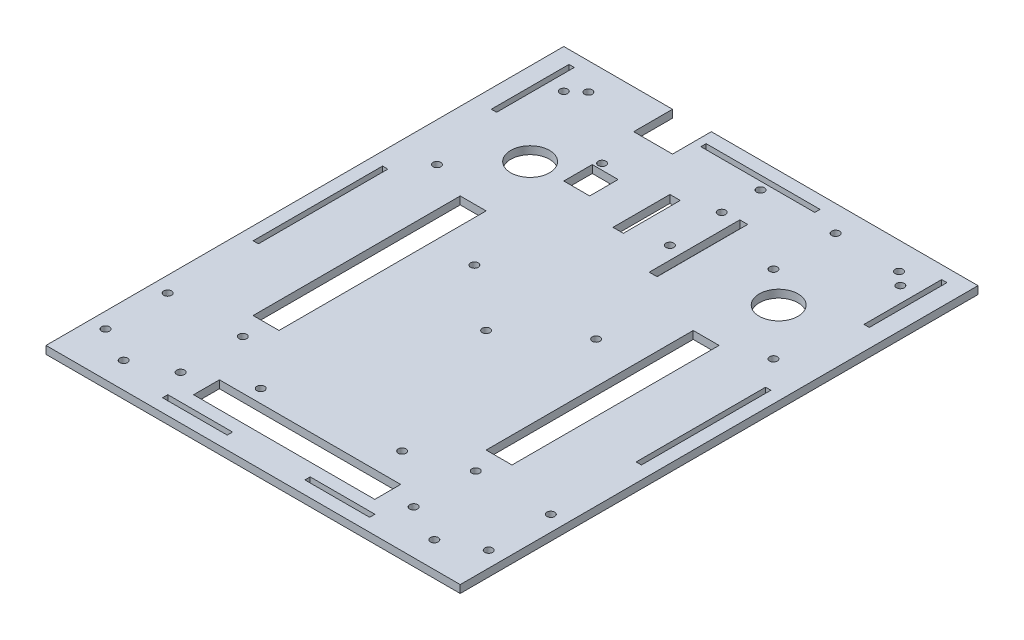
from build123d import *

# Parameters (mm, degrees)
SKETCH1_W           = 160
SKETCH1_H           = 200
BOSS_EXTRUDE1_DEPTH = 3
SKETCH2_R           = 1.5
SKETCH2_W           = 25
SKETCH2_H           = 2.05
SKETCH2_W_2         = 2.05
SKETCH2_H_2         = 50
SKETCH2_H_3         = 30
SKETCH2_W_3         = 15
SKETCH2_H_4         = 15
SKETCH2_W_4         = 44
SKETCH2_W_5         = 4
SKETCH2_H_5         = 22
SKETCH2_W_6         = 3.05
SKETCH2_H_6         = 35
CUT_EXTRUDE1_DEPTH  = 3
SKETCH3_R           = 1.5
CUT_EXTRUDE2_DEPTH  = 129.097619025
SKETCH4_R           = 7.5
SKETCH4_R_2         = 1.5
SKETCH4_W           = 10
SKETCH4_H           = 80
SKETCH4_W_2         = 70
SKETCH4_H_2         = 10
CUT_EXTRUDE3_DEPTH  = 3
SKETCH5_R           = 1.5
CUT_EXTRUDE4_DEPTH  = 10
SKETCH6_R           = 1.5
SKETCH6_W           = 10
SKETCH6_H           = 11
CUT_EXTRUDE5_DEPTH  = 10


with BuildPart() as part:
    # Sketch1 → Boss-Extrude1 (new body)
    with BuildSketch(Plane(origin=(0, 0, 0), x_dir=(1, 0, 0), z_dir=(0, 1, 0))):
        Rectangle(SKETCH1_W, SKETCH1_H)
    extrude(amount=BOSS_EXTRUDE1_DEPTH)

    # Sketch2 → Cut-Extrude1 (cut)
    with BuildSketch(Plane(origin=(0, 3, 0), x_dir=(1, 0, 0), z_dir=(0, 1, 0))):
        with Locations(Location((-60, -90, 0), (0, 0, 270))):
            Circle(SKETCH2_R)
        with Locations(Location((60, -90, 0), (0, 0, 90))):
            Circle(SKETCH2_R)
        with Locations(Location((0, -10, 0), (0, 0, 270))):
            Circle(SKETCH2_R)
        with Locations(Location((-65, 85, 0), (0, 0, 270))):
            Circle(SKETCH2_R)
        with Locations(Location((65, 85, 0), (0, 0, 90))):
            Circle(SKETCH2_R)
        with Locations((27.5, -93.975)):
            Rectangle(SKETCH2_W, SKETCH2_H)
        with Locations((-27.5, -93.975)):
            Rectangle(SKETCH2_W, SKETCH2_H)
        with Locations((73.975, 0)):
            Rectangle(SKETCH2_W_2, SKETCH2_H_2)
        with Locations((-73.975, 0)):
            Rectangle(SKETCH2_W_2, SKETCH2_H_2)
        with Locations((71.975, 80)):
            Rectangle(SKETCH2_W_2, SKETCH2_H_3)
        with Locations((-30.5, 92.5)):
            Rectangle(SKETCH2_W_3, SKETCH2_H_4)
        with Locations((2, 93.975)):
            Rectangle(SKETCH2_W_4, SKETCH2_H)
        with Locations((-71.975, 80)):
            Rectangle(SKETCH2_W_2, SKETCH2_H_3)
        with Locations((-8, 60)):
            Rectangle(SKETCH2_W_5, SKETCH2_H_5)
        with Locations((13.525, 58.5)):
            Rectangle(SKETCH2_W_6, SKETCH2_H_6)
    extrude(amount=-CUT_EXTRUDE1_DEPTH, mode=Mode.SUBTRACT)

    # Sketch3 → Cut-Extrude2 (cut, through all)
    with BuildSketch(Plane(origin=(0, 3, 0), x_dir=(1, 0, 0), z_dir=(0, 1, 0))):
        with Locations(Location((-24.13, 9.6, 0), (0, 0, 270))):
            Circle(SKETCH3_R)
        with Locations(Location((24.13, 8.36, 0), (0, 0, 270))):
            Circle(SKETCH3_R)
        with Locations(Location((-24.13, -72.92, 0), (0, 0, 270))):
            Circle(SKETCH3_R)
        with Locations(Location((24.13, -66.57, 0), (0, 0, 270))):
            Circle(SKETCH3_R)
    extrude(amount=-CUT_EXTRUDE2_DEPTH, mode=Mode.SUBTRACT)

    # Sketch4 → Cut-Extrude3 (cut)
    with BuildSketch(Plane(origin=(0, 3, 0), x_dir=(1, 0, 0), z_dir=(0, 1, 0))):
        with Locations(Location((-48, 55, 0), (0, 0, 270))):
            Circle(SKETCH4_R)
        with Locations(Location((48, 55, 0), (0, 0, 90))):
            Circle(SKETCH4_R)
        with Locations(Location((-60, 89.5, 0), (0, 0, 270))):
            Circle(SKETCH4_R_2)
        with Locations(Location((60, 89.5, 0), (0, 0, 90))):
            Circle(SKETCH4_R_2)
        with Locations(Location((-65, 36, 0), (0, 0, 270))):
            Circle(SKETCH4_R_2)
        with Locations(Location((65, 36, 0), (0, 0, 90))):
            Circle(SKETCH4_R_2)
        with Locations((-45, -10)):
            Rectangle(SKETCH4_W, SKETCH4_H)
        with Locations((45, -10)):
            Rectangle(SKETCH4_W, SKETCH4_H)
        with Locations((0, -83)):
            Rectangle(SKETCH4_W_2, SKETCH4_H_2)
    extrude(amount=-CUT_EXTRUDE3_DEPTH, mode=Mode.SUBTRACT)

    # Sketch5 → Cut-Extrude4 (cut)
    with BuildSketch(Plane(origin=(0, 3, 0), x_dir=(1, 0, 0), z_dir=(0, 1, 0))):
        with Locations(Location((-74, -83, 0), (0, 0, 270))):
            Circle(SKETCH5_R)
        with Locations(Location((-74, -59, 0), (0, 0, 270))):
            Circle(SKETCH5_R)
        with Locations(Location((-45, -83, 0), (0, 0, 270))):
            Circle(SKETCH5_R)
        with Locations(Location((-45, -59, 0), (0, 0, 270))):
            Circle(SKETCH5_R)
        with Locations(Location((45, -83, 0), (0, 0, 270))):
            Circle(SKETCH5_R)
        with Locations(Location((45, -59, 0), (0, 0, 270))):
            Circle(SKETCH5_R)
        with Locations(Location((74, -83, 0), (0, 0, 270))):
            Circle(SKETCH5_R)
        with Locations(Location((74, -59, 0), (0, 0, 270))):
            Circle(SKETCH5_R)
        with Locations(Location((6, 90, 0), (0, 0, 270))):
            Circle(SKETCH5_R)
        with Locations(Location((6, 75, 0), (0, 0, 270))):
            Circle(SKETCH5_R)
        with Locations(Location((35.0050005, 90, 0), (0, 0, 270))):
            Circle(SKETCH5_R)
        with Locations(Location((35, 66.000000521, 0), (0, 0, 270))):
            Circle(SKETCH5_R)
    extrude(amount=-CUT_EXTRUDE4_DEPTH, mode=Mode.SUBTRACT)

    # Sketch6 → Cut-Extrude5 (cut)
    with BuildSketch(Plane(origin=(0, 3, 0), x_dir=(1, 0, 0), z_dir=(0, 1, 0))):
        with Locations(Location((-33.5, 68.3, 0), (0, 0, 270))):
            Circle(SKETCH6_R)
        with Locations(Location((7, 54, 0), (0, 0, 270))):
            Circle(SKETCH6_R)
        with Locations((-30, 60.5)):
            Rectangle(SKETCH6_W, SKETCH6_H)
    extrude(amount=-CUT_EXTRUDE5_DEPTH, mode=Mode.SUBTRACT)


solid = part.part
